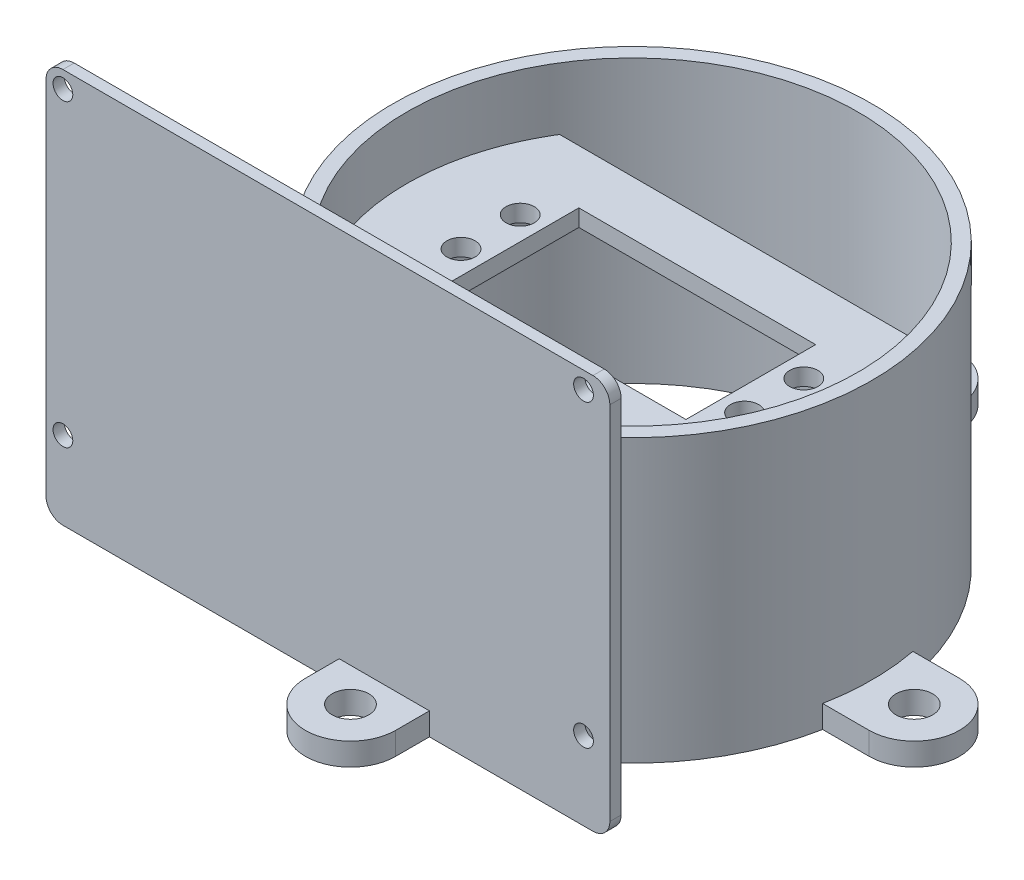
from build123d import *

# Parameters (mm, degrees)
SKETCH1_R           = 42.5
SKETCH1_R_2         = 40
BOSS_EXTRUDE1_DEPTH = 50
SKETCH2_R           = 3.25
BOSS_EXTRUDE2_DEPTH = 4
CIRPATTERN1_COUNT   = 4
BOSS_EXTRUDE3_DEPTH = 3
SKETCH3_R           = 2.5
SKETCH3_W           = 42
SKETCH3_H           = 23
CUT_EXTRUDE1_DEPTH  = 3
BOSS_EXTRUDE4_START = 42
SKETCH5_W           = 100
SKETCH5_H           = 70
SKETCH5_R           = 1.75
BOSS_EXTRUDE4_DEPTH = 2
FILLET1_R           = 3


with BuildPart() as part:
    # Sketch1 → Boss-Extrude1 (new body)
    with BuildSketch(Plane(origin=(0, 0, 0), x_dir=(1, 0, 0), z_dir=(0, 1, 0))):
        with Locations(Location((0, 0, 0), (0, 0, 270))):
            Circle(SKETCH1_R)
        with Locations(Location((0, 0, 0), (0, 0, 270))):
            Circle(SKETCH1_R_2, mode=Mode.SUBTRACT)
    extrude(amount=BOSS_EXTRUDE1_DEPTH)

    # Sketch2 → Boss-Extrude2 (add)
    with BuildSketch(Plane.XZ):
        with BuildLine():
            Line((50.000268327, 8), (41.740268327, 8))
            ThreePointArc((41.740268327, 8), (42.309640768, 4.017996771), (42.5, 0))
            ThreePointArc((42.5, 0), (42.309640768, -4.017996771), (41.740268327, -8))
            Line((41.740268327, -8), (50.000268327, -8))
            ThreePointArc((50.000268327, -8), (58.000268327, 0), (50.000268327, 8))
        make_face()
        with Locations(Location((50.000268327, 0, 0), (0, 0, 270))):
            Circle(SKETCH2_R, mode=Mode.SUBTRACT)
    boss_extrude2 = extrude(amount=-BOSS_EXTRUDE2_DEPTH)

    # CirPattern1: Boss-Extrude2 ×4 about axis
    cirpattern1_axis = Axis((0, 0, 0), (0, 1, 0))
    for i in range(1, CIRPATTERN1_COUNT):
        add(boss_extrude2.rotate(cirpattern1_axis, i * 360 / CIRPATTERN1_COUNT))

    # Sketch5 → Boss-Extrude4 (add)
    with BuildSketch(Plane.XY.offset(BOSS_EXTRUDE4_START)):
        with Locations((-10, 35)):
            Rectangle(SKETCH5_W, SKETCH5_H)
        with Locations((-57, 67)):
            Circle(SKETCH5_R, mode=Mode.SUBTRACT)
        with Locations((35.33, 67)):
            Circle(SKETCH5_R, mode=Mode.SUBTRACT)
        with Locations((-57, 13.85)):
            Circle(SKETCH5_R, mode=Mode.SUBTRACT)
        with Locations((35.33, 13.85)):
            Circle(SKETCH5_R, mode=Mode.SUBTRACT)
    extrude(amount=BOSS_EXTRUDE4_DEPTH)

    # Fillet1
    fillet1_edges = [part.edges().sort_by_distance(p)[0] for p in [
        (-60, 0, 43),
        (-60, 70, 43),
        (40, 0, 43),
        (40, 70, 43),
    ]]
    fillet(fillet1_edges, radius=FILLET1_R)


with BuildPart() as body_2:
    # Sketch4 → Boss-Extrude3 (new body)
    with BuildSketch(Plane(origin=(0, 36, 0), x_dir=(1, 0, 0), z_dir=(0, 1, 0))):
        with BuildLine():
            Line((34, -21.071307506), (-34, -21.071307506))
            ThreePointArc((-34, -21.071307506), (-40, 0), (-34, 21.071307506))
            Line((-34, 21.071307506), (34, 21.071307506))
            ThreePointArc((34, 21.071307506), (40, 0), (34, -21.071307506))
        make_face()
    extrude(amount=BOSS_EXTRUDE3_DEPTH)

    # Sketch3 → Cut-Extrude1 (cut)
    with BuildSketch(Plane(origin=(0, 39, 0), x_dir=(1, 0, 0), z_dir=(0, 1, 0))):
        with Locations(Location((25.15, 5.25, 0), (0, 0, 270))):
            Circle(SKETCH3_R)
        with Locations(Location((25.15, -5.25, 0), (0, 0, 270))):
            Circle(SKETCH3_R)
        with Locations(Location((-25.15, -5.25, 0), (0, 0, 270))):
            Circle(SKETCH3_R)
        with Locations(Location((-25.15, 5.25, 0), (0, 0, 270))):
            Circle(SKETCH3_R)
        Rectangle(SKETCH3_W, SKETCH3_H)
    extrude(amount=-CUT_EXTRUDE1_DEPTH, mode=Mode.SUBTRACT)


solid = Compound([part.part, body_2.part])
